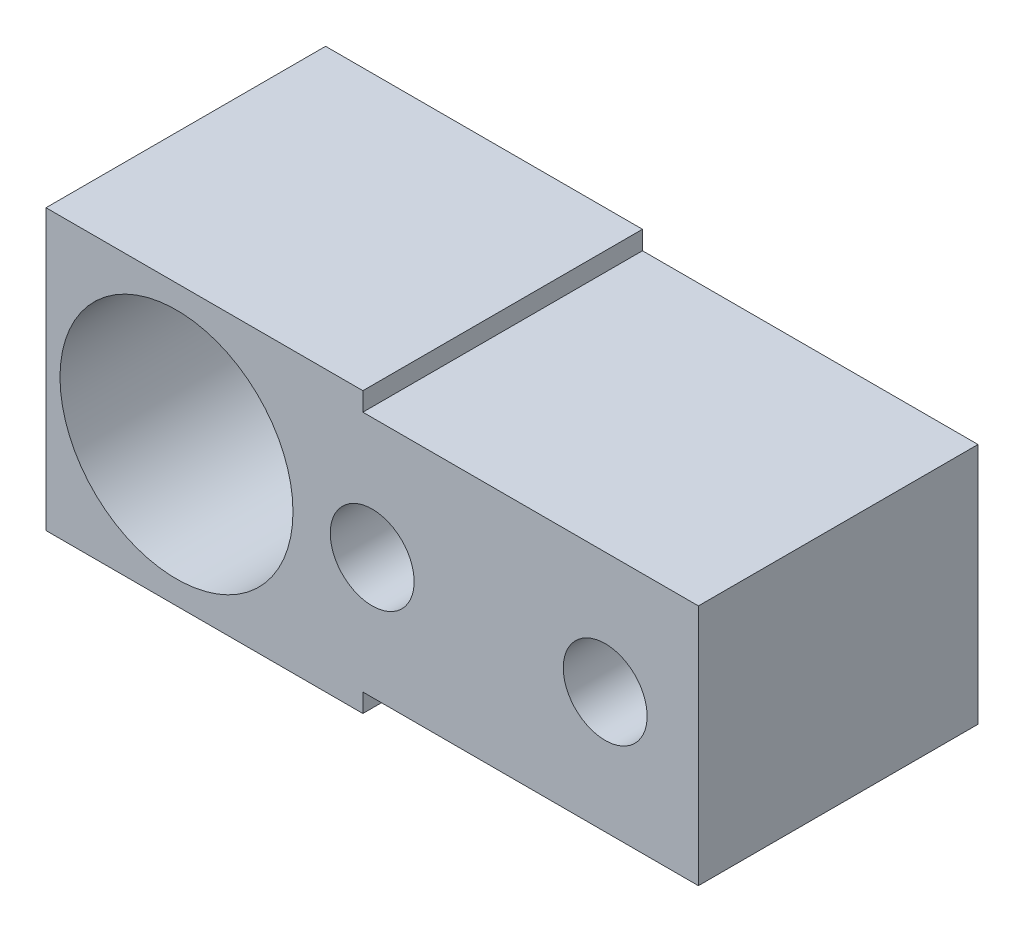
from build123d import *

# Parameters (mm, degrees)
AUFSATZ_LINEAR_AUSTRAGEN1_DEPTH                      = 30
SKIZZE6_R                                            = 12.5
SCHNITT_LINEAR_AUSTRAGEN1_DEPTH                      = 20
M16_GEWINDEBOHRUNG1_D                                = 14
M16_GEWINDEBOHRUNG1_DEPTH                            = 42
M16_GEWINDEBOHRUNG1_TIP                              = 4.206024333
STIRNSENKUNG_F_R_M8_ZYLINDERSCHRAUBE_MIT_D           = 9
STIRNSENKUNG_F_R_M8_ZYLINDERSCHRAUBE_MIT_CBORE_D     = 15
STIRNSENKUNG_F_R_M8_ZYLINDERSCHRAUBE_MIT_CBORE_DEPTH = 8.6
FASE1_SIZE                                           = 0.5


with BuildPart() as part:
    # Skizze1 → Aufsatz-Linear austragen1 (new body)
    with BuildSketch(Plane.XY):
        Polygon((34, 15), (34, 13), (70, 13), (70, -13), (34, -13), (34, -15), (0, -15), (0, 15), align=None)
    extrude(amount=AUFSATZ_LINEAR_AUSTRAGEN1_DEPTH)

    # Skizze6 → Schnitt-Linear austragen1 (cut)
    with BuildSketch(Plane.XY.offset(30)):
        with Locations((14, 0)):
            Circle(SKIZZE6_R)
    extrude(amount=-SCHNITT_LINEAR_AUSTRAGEN1_DEPTH, mode=Mode.SUBTRACT)

    # M16 Gewindebohrung1
    with Locations(Plane(origin=(0, 0, 0), x_dir=(-1, 0, 0), z_dir=(0, 0, -1))):
        with Locations((-14, 0)):
            Hole(M16_GEWINDEBOHRUNG1_D / 2, depth=M16_GEWINDEBOHRUNG1_DEPTH)
            with Locations((0, 0, -(M16_GEWINDEBOHRUNG1_DEPTH + M16_GEWINDEBOHRUNG1_TIP / 2))):  # 118° drill point
                Cone(0, M16_GEWINDEBOHRUNG1_D / 2, M16_GEWINDEBOHRUNG1_TIP, mode=Mode.SUBTRACT)

    # Stirnsenkung für M8 Zylinderschraube mit Innensechskant1 (through all)
    with Locations(Plane(origin=(0, 0, 0), x_dir=(-1, 0, 0), z_dir=(0, 0, -1))):
        with Locations((-60, 0), (-35, 0)):
            CounterBoreHole(STIRNSENKUNG_F_R_M8_ZYLINDERSCHRAUBE_MIT_D / 2, STIRNSENKUNG_F_R_M8_ZYLINDERSCHRAUBE_MIT_CBORE_D / 2, STIRNSENKUNG_F_R_M8_ZYLINDERSCHRAUBE_MIT_CBORE_DEPTH)

    # Fase1
    fase1_edges = [part.edges().sort_by_distance(p)[0] for p in [
        (7, 0, 10),
    ]]
    chamfer(fase1_edges, length=FASE1_SIZE)


solid = part.part
